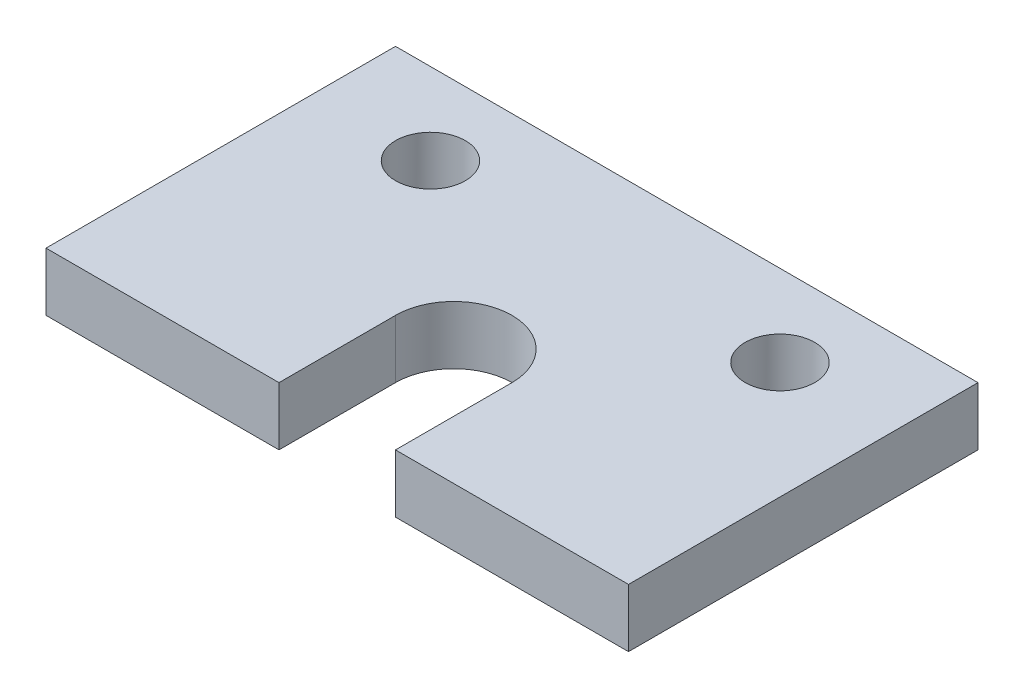
from build123d import *

# Parameters (mm, degrees)
SKETCH1_W             = 31.75
SKETCH1_H             = 19.05
BOSS_EXTRUDE1_DEPTH   = 3.175
CUT_EXTRUDE1_DEPTH    = 19.783553311
F_6_CLEARANCE_HOLE1_D = 3.7973


with BuildPart() as part:
    # Sketch1 → Boss-Extrude1 (new body)
    with BuildSketch(Plane(origin=(0, 0, 0), x_dir=(1, 0, 0), z_dir=(0, 1, 0))):
        Rectangle(SKETCH1_W, SKETCH1_H)
    extrude(amount=BOSS_EXTRUDE1_DEPTH)

    # Sketch2 → Cut-Extrude1 (cut, through all)
    with BuildSketch(Plane(origin=(0, 3.175, 0), x_dir=(1, 0, 0), z_dir=(0, 1, 0))):
        with BuildLine():
            Line((-3.175, -3.175), (-3.175, -9.525))
            Line((-3.175, -9.525), (3.175, -9.525))
            Line((3.175, -9.525), (3.175, -3.175))
            ThreePointArc((3.175, -3.175), (0, 0), (-3.175, -3.175))
        make_face()
    extrude(amount=-CUT_EXTRUDE1_DEPTH, mode=Mode.SUBTRACT)

    # #6 Clearance Hole1 (through all)
    with Locations(Plane(origin=(0, 3.175, 0), x_dir=(1, 0, 0), z_dir=(0, 1, 0))):
        with Locations((-9.525, 5.08), (9.525, 5.08)):
            Hole(F_6_CLEARANCE_HOLE1_D / 2)


solid = part.part
